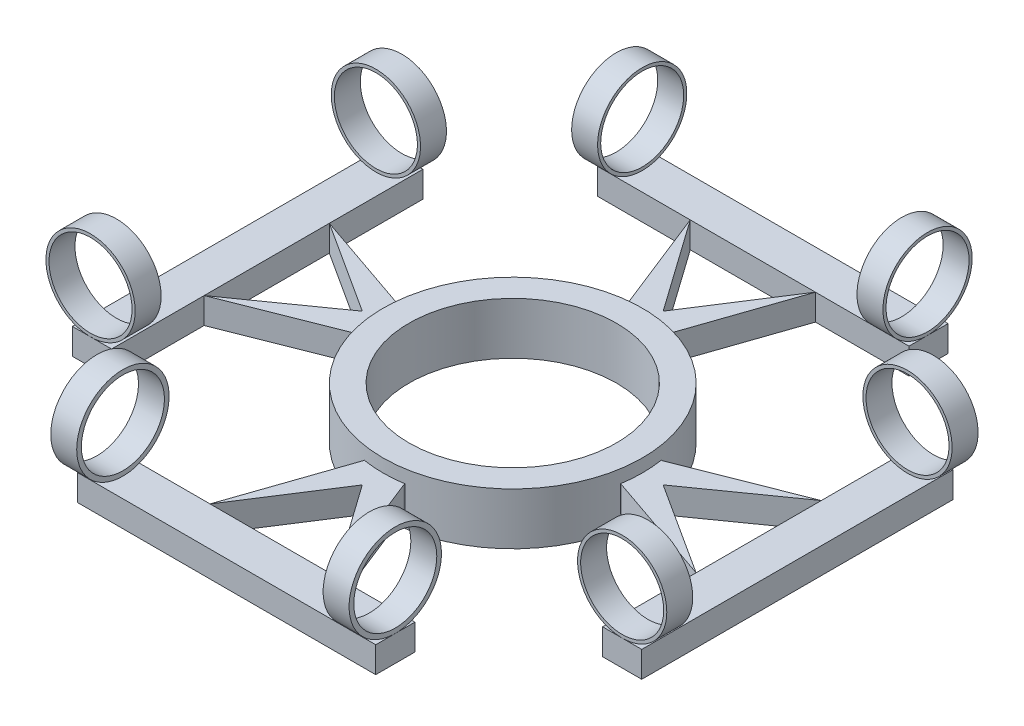
from build123d import *

# Parameters (mm, degrees)
SKETCH1_R            = 2.5
SKETCH1_R_2          = 2
BOSS_EXTRUDE1_DEPTH  = 0.5
BOSS_EXTRUDE2_DEPTH  = 0.25
SKETCH4_R            = 0.890475272
BOSS_EXTRUDE3_DEPTH  = 0.25
SKETCH5_R            = 0.890475272
BOSS_EXTRUDE4_DEPTH  = 0.5
SKETCH6_R            = 0.86
BOSS_EXTRUDE5_DEPTH  = 0.5
SKETCH7_R            = 0.86
BOSS_EXTRUDE6_DEPTH  = 0.5
SKETCH8_R            = 0.8
CUT_EXTRUDE1_DEPTH   = 11.486117126
SKETCH9_R            = 0.8
CUT_EXTRUDE2_DEPTH   = 11.561450537
SKETCH10_R           = 0.86
BOSS_EXTRUDE7_DEPTH  = 0.5
SKETCH11_R           = 0.86
BOSS_EXTRUDE8_DEPTH  = 0.5
SKETCH12_R           = 0.86
SKETCH12_W           = 0.754080165
SKETCH12_H           = 0.5
BOSS_EXTRUDE9_DEPTH  = 0.5
SKETCH13_R           = 0.86
SKETCH13_W           = 0.754080165
SKETCH13_H           = 0.5
BOSS_EXTRUDE10_DEPTH = 0.5
SKETCH14_R           = 0.8
CUT_EXTRUDE3_DEPTH   = 11.860009477
SKETCH15_R           = 0.8
CUT_EXTRUDE4_DEPTH   = 11.899515797


with BuildPart() as part:
    # Sketch1 → Boss-Extrude1 (new, symmetric)
    with BuildSketch(Plane(origin=(0, 0, 0), x_dir=(1, 0, 0), z_dir=(0, 1, 0))):
        with Locations(Location((0, 0, 0), (0, 0, 270))):
            Circle(SKETCH1_R)
        with Locations(Location((0, 0, 0), (0, 0, 270))):
            Circle(SKETCH1_R_2, mode=Mode.SUBTRACT)
    extrude(amount=BOSS_EXTRUDE1_DEPTH, both=True)

    # Sketch3 → Boss-Extrude2 (add, symmetric)
    with BuildSketch(Plane(origin=(0, 0, 0), x_dir=(1, 0, 0), z_dir=(0, 1, 0))):
        with BuildLine():
            Line((-1.263037005, 4.684547697), (-0.399696275, 2.5))
            Line((-0.399696275, 2.5), (-0.39468382, 2.468648351))
            ThreePointArc((-0.39468382, 2.468648351), (0, 2.5), (0.39468382, 2.468648351))
            Line((0.39468382, 2.468648351), (0.399696275, 2.5))
            Line((0.399696275, 2.5), (1.149929213, 4.684547697))
            Line((1.149929213, 4.684547697), (0, 2.899696275))
            Line((0, 2.899696275), (-1.263037005, 4.684547697))
        make_face()
        Polygon((-2.547749619, 4.684547697), (-1.263037005, 4.684547697), (1.149929213, 4.684547697), (2.452250381, 4.684547697), (2.452250381, 5.438627862), (-2.547749619, 5.438627862), align=None)
        with BuildLine():
            ThreePointArc((-2.468648351, -0.39468382), (-2.5, 0), (-2.468648351, 0.39468382))
            Line((-2.468648351, 0.39468382), (-2.5, 0.399696275))
            Line((-2.5, 0.399696275), (-4.684547697, 1.149929213))
            Line((-4.684547697, 1.149929213), (-2.899696275, 0))
            Line((-2.899696275, 0), (-4.684547697, -1.263037005))
            Line((-4.684547697, -1.263037005), (-2.5, -0.399696275))
            Line((-2.5, -0.399696275), (-2.468648351, -0.39468382))
        make_face()
        with BuildLine():
            ThreePointArc((2.468648351, 0.39468382), (2.5, 0), (2.468648351, -0.39468382))
            Line((2.468648351, -0.39468382), (2.5, -0.399696275))
            Line((2.5, -0.399696275), (4.684547697, -1.149929213))
            Line((4.684547697, -1.149929213), (2.899696275, 0))
            Line((2.899696275, 0), (4.684547697, 1.263037005))
            Line((4.684547697, 1.263037005), (2.5, 0.399696275))
            Line((2.5, 0.399696275), (2.468648351, 0.39468382))
        make_face()
        with BuildLine():
            Line((0.399696275, -2.5), (0.39468382, -2.468648351))
            ThreePointArc((0.39468382, -2.468648351), (0, -2.5), (-0.39468382, -2.468648351))
            Line((-0.39468382, -2.468648351), (-0.399696275, -2.5))
            Line((-0.399696275, -2.5), (-1.149929213, -4.684547697))
            Line((-1.149929213, -4.684547697), (0, -2.899696275))
            Line((0, -2.899696275), (1.263037005, -4.684547697))
            Line((1.263037005, -4.684547697), (0.399696275, -2.5))
        make_face()
        Polygon((-4.684547697, -1.263037005), (-4.684547697, 1.149929213), (-4.684547697, 2.452250381), (-5.438627862, 2.452250381), (-5.438627862, -2.547749619), (-4.684547697, -2.547749619), align=None)
        Polygon((4.684547697, 1.263037005), (4.684547697, -1.149929213), (4.684547697, -2.452250381), (5.438627862, -2.452250381), (5.438627862, 2.547749619), (4.684547697, 2.547749619), align=None)
        Polygon((2.547749619, -4.684547697), (1.263037005, -4.684547697), (-1.149929213, -4.684547697), (-2.452250381, -4.684547697), (-2.452250381, -5.438627862), (2.547749619, -5.438627862), align=None)
    extrude(amount=BOSS_EXTRUDE2_DEPTH, both=True)


with BuildPart() as boss_extrude2_piece_1:
    # of the separate pieces the step leaves, piece 1, a body of its own (boss_extrude2_pieces)
    add(part.part.solids().sort_by_distance((0, -0.5, 2.5))[0])


with BuildPart() as boss_extrude2_piece_2:
    # of the separate pieces the step leaves, piece 2, a body of its own (boss_extrude2_pieces)
    add(part.part.solids().sort_by_distance((5.438627862, -0.25, -2.547749619))[0])

    # Sketch12 → Boss-Extrude9 (add)
    with BuildSketch(Plane(origin=(0, 0, -2.547749619), x_dir=(-1, 0, 0), z_dir=(0, 0, -1))):
        with Locations((-5.06158778, 1.11)):
            Circle(SKETCH12_R)
        with Locations((-5.061587779, 0)):
            Rectangle(SKETCH12_W, SKETCH12_H)
    extrude(amount=BOSS_EXTRUDE9_DEPTH)


with BuildPart() as boss_extrude2_piece_3:
    # of the separate pieces the step leaves, piece 3, a body of its own (boss_extrude2_pieces)
    add(part.part.solids().sort_by_distance((-2.547749619, 0.25, -4.684547697))[0])

    # Sketch10 → Boss-Extrude7 (add)
    with BuildSketch(Plane.ZY.offset(2.547749619)):
        Polygon((-5.438627862, 0.25), (-5.438627862, -0.25), (-4.684547697, -0.25), (-4.684547697, 0.25), (-5.042927266, 0.25), align=None)
        with Locations((-5.042927266, 1.11)):
            Circle(SKETCH10_R)
    extrude(amount=BOSS_EXTRUDE7_DEPTH)


with BuildPart() as boss_extrude2_piece_4:
    # of the separate pieces the step leaves, piece 4, a body of its own (boss_extrude2_pieces)
    add(part.part.solids().sort_by_distance((-4.684547697, 0.25, 2.547749619))[0])

    # Sketch6 → Boss-Extrude5 (add)
    with BuildSketch(Plane.XY.offset(2.547749619)):
        with Locations((-5.089863408, 1.11)):
            Circle(SKETCH6_R)
        Polygon((-5.438627862, 0.25), (-5.438627862, -0.25), (-4.684547697, -0.25), (-4.684547697, 0.25), (-5.089863408, 0.25), align=None)
    extrude(amount=BOSS_EXTRUDE5_DEPTH)


with BuildPart() as boss_extrude2_piece_5:
    # of the separate pieces the step leaves, piece 5, a body of its own (boss_extrude2_pieces)
    add(part.part.solids().sort_by_distance((2.547749619, 0.25, 4.684547697))[0])

    # Sketch4 → Boss-Extrude3 (add, symmetric)
    with BuildSketch(Plane(origin=(2.547749619, 0, 0), x_dir=(0, 0, -1), z_dir=(1, 0, 0))):
        Polygon((-5.06158778, 0.25), (-5.438627862, 0.25), (-5.438627862, -0.25), (-4.684547697, -0.25), (-4.684547697, 0.25), align=None)
        with Locations((-5.06158778, 1.140475272)):
            Circle(SKETCH4_R)
    extrude(amount=BOSS_EXTRUDE3_DEPTH, both=True)


with BuildPart() as boss_extrude3_piece_1:
    # of the separate pieces the step leaves, piece 1, a body of its own (boss_extrude3_pieces)
    add(boss_extrude2_piece_5.part.solids().sort_by_distance((2.297749619, 0.25, 4.684547697))[0])

    # Sketch5 → Boss-Extrude4 (add)
    with BuildSketch(Plane.ZY.offset(2.452250381)):
        with Locations((5.06158778, 1.140475272)):
            Circle(SKETCH5_R)
        Polygon((4.684547697, 0.25), (4.684547697, -0.25), (5.438627862, -0.25), (5.438627862, 0.25), (5.06158778, 0.25), align=None)
    extrude(amount=BOSS_EXTRUDE4_DEPTH)


with BuildPart() as boss_extrude3_piece_2:
    # of the separate pieces the step leaves, piece 2, a body of its own (boss_extrude3_pieces)
    add(boss_extrude2_piece_5.part.solids().sort_by_distance((2.297749619, 1.140475272, 4.171112508))[0])


with BuildPart() as boss_extrude4_piece_1:
    # of the separate pieces the step leaves, piece 1, a body of its own (boss_extrude4_pieces)
    add(boss_extrude3_piece_1.part.solids().sort_by_distance((2.797749619, -0.25, 4.684547697))[0])


with BuildPart() as boss_extrude4_piece_2:
    # of the separate pieces the step leaves, piece 2, a body of its own (boss_extrude4_pieces)
    add(boss_extrude3_piece_1.part.solids().sort_by_distance((-2.452250381, 1.140475272, 5.952063052))[0])


with BuildPart() as boss_extrude5_piece_1:
    # of the separate pieces the step leaves, piece 1, a body of its own (boss_extrude5_pieces)
    add(boss_extrude2_piece_4.part.solids().sort_by_distance((-4.684547697, 0.25, 2.547749619))[0])

    # Sketch7 → Boss-Extrude6 (add)
    with BuildSketch(Plane(origin=(0, 0, -2.452250381), x_dir=(-1, 0, 0), z_dir=(0, 0, -1))):
        with Locations((5.089863408, 1.11)):
            Circle(SKETCH7_R)
        Polygon((4.684547697, 0.25), (4.684547697, -0.25), (5.438627862, -0.25), (5.438627862, 0.25), (5.089863408, 0.25), align=None)
    extrude(amount=BOSS_EXTRUDE6_DEPTH)


with BuildPart() as boss_extrude5_piece_2:
    # of the separate pieces the step leaves, piece 2, a body of its own (boss_extrude5_pieces)
    add(boss_extrude2_piece_4.part.solids().sort_by_distance((-4.229863408, 1.11, 2.547749619))[0])


with BuildPart() as boss_extrude6_piece_1:
    # of the separate pieces the step leaves, piece 1, a body of its own (boss_extrude6_pieces)
    add(boss_extrude5_piece_1.part.solids().sort_by_distance((-4.684547697, -0.25, 3.047749619))[0])


with BuildPart() as boss_extrude6_piece_2:
    # of the separate pieces the step leaves, piece 2, a body of its own (boss_extrude6_pieces)
    add(boss_extrude5_piece_1.part.solids().sort_by_distance((-5.949863408, 1.11, -2.452250381))[0])


with BuildPart() as cut_extrude1_tool:
    # Sketch8 → Cut-Extrude1 (new, through all)
    with BuildSketch(Plane.ZY.offset(2.952250381)):
        with Locations((5.06158778, 1.140475272)):
            Circle(SKETCH8_R)
    extrude(amount=-CUT_EXTRUDE1_DEPTH)


with BuildPart() as boss_extrude3_piece_2_1:
    add(boss_extrude3_piece_2.part)

    # Cut-Extrude1: cut by cut_extrude1_tool
    add(cut_extrude1_tool.part, mode=Mode.SUBTRACT)


with BuildPart() as boss_extrude4_piece_2_1:
    add(boss_extrude4_piece_2.part)

    # Cut-Extrude1: cut by cut_extrude1_tool
    add(cut_extrude1_tool.part, mode=Mode.SUBTRACT)


with BuildPart() as cut_extrude2_tool:
    # Sketch9 → Cut-Extrude2 (new, through all)
    with BuildSketch(Plane.XY.offset(3.047749619)):
        with Locations(Location((-5.089863408, 1.11, 0), (0, 0, 180))):
            Circle(SKETCH9_R)
    extrude(amount=-CUT_EXTRUDE2_DEPTH)


with BuildPart() as boss_extrude5_piece_2_1:
    add(boss_extrude5_piece_2.part)

    # Cut-Extrude2: cut by cut_extrude2_tool
    add(cut_extrude2_tool.part, mode=Mode.SUBTRACT)


with BuildPart() as boss_extrude6_piece_2_1:
    add(boss_extrude6_piece_2.part)

    # Cut-Extrude2: cut by cut_extrude2_tool
    add(cut_extrude2_tool.part, mode=Mode.SUBTRACT)


with BuildPart() as boss_extrude7_piece_1:
    # of the separate pieces the step leaves, piece 1, a body of its own (boss_extrude7_pieces)
    add(boss_extrude2_piece_3.part.solids().sort_by_distance((-2.547749619, 0.25, -4.684547697))[0])

    # Sketch11 → Boss-Extrude8 (add)
    with BuildSketch(Plane(origin=(2.452250381, 0, 0), x_dir=(0, 0, -1), z_dir=(1, 0, 0))):
        with Locations((5.042927266, 1.11)):
            Circle(SKETCH11_R)
        Polygon((4.684547697, 0.25), (4.684547697, -0.25), (5.438627862, -0.25), (5.438627862, 0.25), (5.042927266, 0.25), align=None)
    extrude(amount=BOSS_EXTRUDE8_DEPTH)


with BuildPart() as boss_extrude7_piece_2:
    # of the separate pieces the step leaves, piece 2, a body of its own (boss_extrude7_pieces)
    add(boss_extrude2_piece_3.part.solids().sort_by_distance((-2.547749619, 1.11, -4.182927266))[0])


with BuildPart() as boss_extrude8_piece_1:
    # of the separate pieces the step leaves, piece 1, a body of its own (boss_extrude8_pieces)
    add(boss_extrude7_piece_1.part.solids().sort_by_distance((-3.047749619, -0.25, -4.684547697))[0])


with BuildPart() as boss_extrude8_piece_2:
    # of the separate pieces the step leaves, piece 2, a body of its own (boss_extrude8_pieces)
    add(boss_extrude7_piece_1.part.solids().sort_by_distance((2.452250381, 1.11, -5.902927266))[0])


with BuildPart() as boss_extrude9_piece_1:
    # of the separate pieces the step leaves, piece 1, a body of its own (boss_extrude9_pieces)
    add(boss_extrude2_piece_2.part.solids().sort_by_distance((4.684547697, -0.25, 2.452250381))[0])

    # Sketch13 → Boss-Extrude10 (add)
    with BuildSketch(Plane.XY.offset(2.452250381)):
        with Locations((5.06158778, 1.11)):
            Circle(SKETCH13_R)
        with Locations((5.061587779, 0)):
            Rectangle(SKETCH13_W, SKETCH13_H)
    extrude(amount=BOSS_EXTRUDE10_DEPTH)


with BuildPart() as boss_extrude9_piece_2:
    # of the separate pieces the step leaves, piece 2, a body of its own (boss_extrude9_pieces)
    add(boss_extrude2_piece_2.part.solids().sort_by_distance((4.20158778, 1.11, -2.547749619))[0])


with BuildPart() as boss_extrude10_piece_1:
    # of the separate pieces the step leaves, piece 1, a body of its own (boss_extrude10_pieces)
    add(boss_extrude9_piece_1.part.solids().sort_by_distance((4.684547697, -0.25, 2.952250381))[0])


with BuildPart() as boss_extrude10_piece_2:
    # of the separate pieces the step leaves, piece 2, a body of its own (boss_extrude10_pieces)
    add(boss_extrude9_piece_1.part.solids().sort_by_distance((5.92158778, 1.11, 2.452250381))[0])


with BuildPart() as cut_extrude3_tool:
    # Sketch14 → Cut-Extrude3 (new, through all)
    with BuildSketch(Plane.XY.offset(2.952250381)):
        with Locations((5.06158778, 1.11)):
            Circle(SKETCH14_R)
    extrude(amount=-CUT_EXTRUDE3_DEPTH)


with BuildPart() as boss_extrude9_piece_2_1:
    add(boss_extrude9_piece_2.part)

    # Cut-Extrude3: cut by cut_extrude3_tool
    add(cut_extrude3_tool.part, mode=Mode.SUBTRACT)


with BuildPart() as boss_extrude10_piece_2_1:
    add(boss_extrude10_piece_2.part)

    # Cut-Extrude3: cut by cut_extrude3_tool
    add(cut_extrude3_tool.part, mode=Mode.SUBTRACT)


with BuildPart() as cut_extrude4_tool:
    # Sketch15 → Cut-Extrude4 (new, through all)
    with BuildSketch(Plane(origin=(2.952250381, 0, 0), x_dir=(0, 0, -1), z_dir=(1, 0, 0))):
        with Locations((5.042927266, 1.11)):
            Circle(SKETCH15_R)
    extrude(amount=-CUT_EXTRUDE4_DEPTH)


with BuildPart() as boss_extrude7_piece_2_1:
    add(boss_extrude7_piece_2.part)

    # Cut-Extrude4: cut by cut_extrude4_tool
    add(cut_extrude4_tool.part, mode=Mode.SUBTRACT)


with BuildPart() as boss_extrude8_piece_2_1:
    add(boss_extrude8_piece_2.part)

    # Cut-Extrude4: cut by cut_extrude4_tool
    add(cut_extrude4_tool.part, mode=Mode.SUBTRACT)


solid = Compound([boss_extrude2_piece_1.part, boss_extrude4_piece_1.part, boss_extrude6_piece_1.part, boss_extrude3_piece_2_1.part, boss_extrude4_piece_2_1.part, boss_extrude5_piece_2_1.part, boss_extrude6_piece_2_1.part, boss_extrude8_piece_1.part, boss_extrude10_piece_1.part, boss_extrude9_piece_2_1.part, boss_extrude10_piece_2_1.part, boss_extrude7_piece_2_1.part, boss_extrude8_piece_2_1.part])
